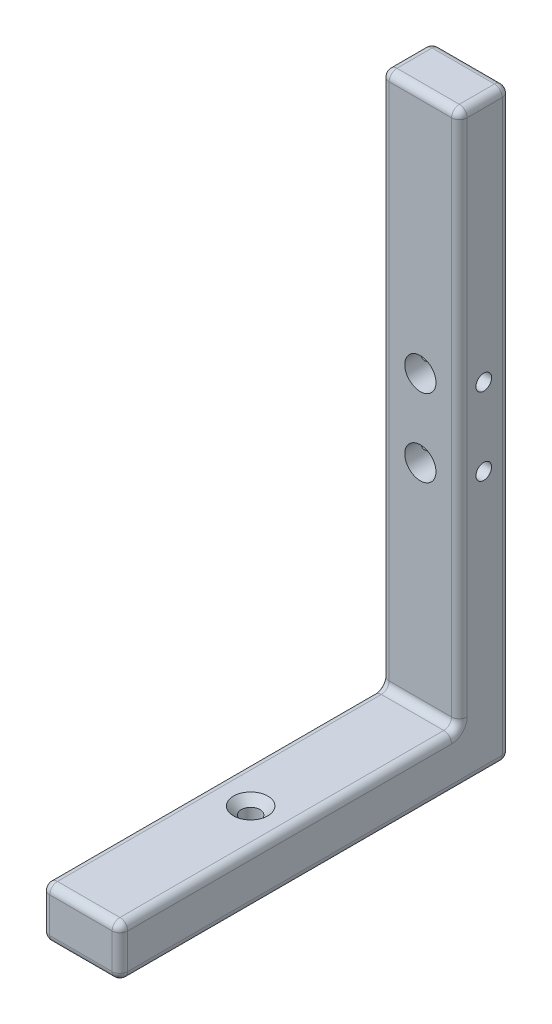
from build123d import *

# Parameters (mm, degrees)
BOSS_EXTRUDE1_DEPTH                                 = 10
CSK_FOR_M2_COUNTERSUNK_FLAT_HEAD_SCREW1_D           = 2.4
CSK_FOR_M2_COUNTERSUNK_FLAT_HEAD_SCREW1_DEPTH       = 30
CSK_FOR_M2_COUNTERSUNK_FLAT_HEAD_SCREW1_CSINK_D     = 4.4
CSK_FOR_M2_COUNTERSUNK_FLAT_HEAD_SCREW1_CSINK_ANGLE = 90
CSK_FOR_M2_COUNTERSUNK_FLAT_HEAD_SCREW1_TIP         = 0.721032743
SKETCH4_R                                           = 1
CUT_EXTRUDE1_DEPTH                                  = 91.691785736
SKETCH5_R                                           = 2
CUT_EXTRUDE2_DEPTH                                  = 88.27685833
FILLET1_R                                           = 1


with BuildPart() as part:
    # Sketch1 → Boss-Extrude1 (new body)
    with BuildSketch(Plane(origin=(0, 0, 0), x_dir=(0, 0, -1), z_dir=(1, 0, 0))):
        Polygon((0, 0), (0, 75), (-6.5, 75), (-6.5, 6.5), (-50, 6.5), (-50, 0), align=None)
    extrude(amount=BOSS_EXTRUDE1_DEPTH)

    # CSK for M2 Countersunk Flat Head Screw1
    with Locations(Plane(origin=(0, 6.5, 0), x_dir=(1, 0, 0), z_dir=(0, 1, 0))):
        with Locations((5, -28.25)):
            CounterSinkHole(CSK_FOR_M2_COUNTERSUNK_FLAT_HEAD_SCREW1_D / 2, CSK_FOR_M2_COUNTERSUNK_FLAT_HEAD_SCREW1_CSINK_D / 2, depth=CSK_FOR_M2_COUNTERSUNK_FLAT_HEAD_SCREW1_DEPTH, counter_sink_angle=CSK_FOR_M2_COUNTERSUNK_FLAT_HEAD_SCREW1_CSINK_ANGLE)
            with Locations((0, 0, -(CSK_FOR_M2_COUNTERSUNK_FLAT_HEAD_SCREW1_DEPTH + CSK_FOR_M2_COUNTERSUNK_FLAT_HEAD_SCREW1_TIP / 2))):  # 118° drill point
                Cone(0, CSK_FOR_M2_COUNTERSUNK_FLAT_HEAD_SCREW1_D / 2, CSK_FOR_M2_COUNTERSUNK_FLAT_HEAD_SCREW1_TIP, mode=Mode.SUBTRACT)

    # Sketch4 → Cut-Extrude1 (cut, through all)
    with BuildSketch(Plane.ZY):
        with Locations((3.370981866, 33.7)):
            Circle(SKETCH4_R)
        with Locations((3.370981866, 43.6)):
            Circle(SKETCH4_R)
    extrude(amount=-CUT_EXTRUDE1_DEPTH, mode=Mode.SUBTRACT)

    # Sketch5 → Cut-Extrude2 (cut, through all)
    with BuildSketch(Plane.XY.offset(6.5)):
        with Locations((5, 43.61)):
            Circle(SKETCH5_R)
        with Locations((5, 33.71)):
            Circle(SKETCH5_R)
    extrude(amount=-CUT_EXTRUDE2_DEPTH, mode=Mode.SUBTRACT)

    # Fillet1
    fillet1_edges = [part.edges().sort_by_distance(p)[0] for p in [
        (5, 0, 50),
        (5, 6.5, 50),
        (5, 6.5, 6.5),
        (5, 75, 6.5),
        (5, 75, 0),
        (5, 0, 0),
        (10, 75, 3.25),
        (10, 40.75, 6.5),
        (10, 6.5, 28.25),
        (10, 3.25, 50),
        (10, 0, 25),
        (0, 3.25, 50),
        (0, 6.5, 28.25),
        (0, 40.75, 6.5),
        (0, 75, 3.25),
        (0, 37.5, 0),
        (0, 0, 25),
        (10, 37.5, 0),
    ]]
    fillet(fillet1_edges, radius=FILLET1_R)


solid = part.part
